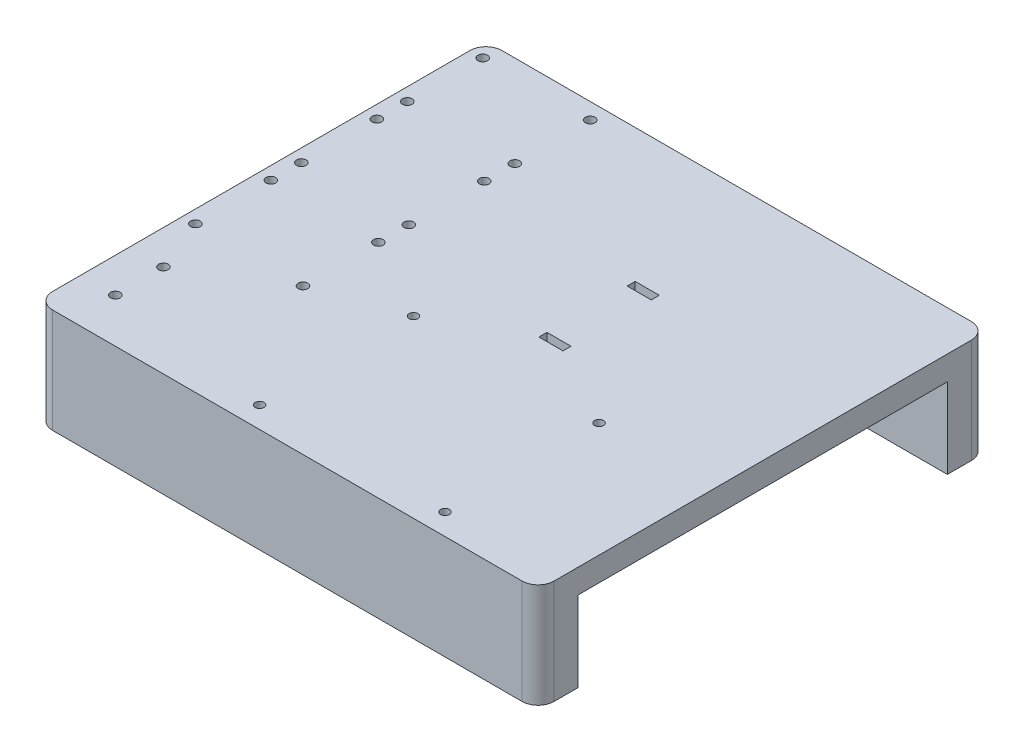
from build123d import *

# Parameters (mm, degrees)
BOSS_EXTRUDE1_DEPTH = 7.62
SKETCH5_W           = 158.75
SKETCH5_H           = 12.7
BOSS_EXTRUDE2_DEPTH = 25.4
FILLET1_R           = 5.08
SKETCH3_R           = 1.397
SKETCH3_R_2         = 1.524
CUT_EXTRUDE1_DEPTH  = 7.62
SKETCH6_W           = 7.62
SKETCH6_H           = 2.54
CUT_EXTRUDE3_DEPTH  = 7.62


with BuildPart() as part:
    # Sketch1 → Boss-Extrude1 (new body)
    with BuildSketch(Plane(origin=(0, 0, 0), x_dir=(1, 0, 0), z_dir=(0, 1, 0))):
        Polygon((0, 0), (120.65, 0), (120.65, 142.24), (-38.1, 142.24), (-38.1, 0), align=None)
    extrude(amount=BOSS_EXTRUDE1_DEPTH)

    # Sketch5 → Boss-Extrude2 (add)
    with BuildSketch(Plane(origin=(0, 0, 0), x_dir=(-1, 0, 0), z_dir=(0, -1, 0))):
        with Locations((-41.275, 6.35)):
            Rectangle(SKETCH5_W, SKETCH5_H)
        with Locations((-41.275, 135.89)):
            Rectangle(SKETCH5_W, SKETCH5_H)
    extrude(amount=BOSS_EXTRUDE2_DEPTH)

    # Fillet1
    fillet1_edges = [part.edges().sort_by_distance(p)[0] for p in [
        (-38.1, -8.89, 0),
        (120.65, -8.89, 0),
        (120.65, -8.89, -142.24),
        (-38.1, -8.89, -142.24),
    ]]
    fillet(fillet1_edges, radius=FILLET1_R)

    # Sketch3 → Cut-Extrude1 (cut)
    with BuildSketch(Plane(origin=(0, 7.62, 0), x_dir=(1, 0, 0), z_dir=(0, 1, 0))):
        with Locations((25.781, 6.731)):
            Circle(SKETCH3_R)
        with Locations((25.781, 55.4355)):
            Circle(SKETCH3_R)
        with Locations((84.455, 55.499)):
            Circle(SKETCH3_R)
        with Locations((84.455, 6.731)):
            Circle(SKETCH3_R)
        with Locations((-34.036, 137.16)):
            Circle(SKETCH3_R_2)
        with Locations((0, 137.16)):
            Circle(SKETCH3_R_2)
        with Locations((-34.036, 113.284)):
            Circle(SKETCH3_R_2)
        with Locations((0, 113.284)):
            Circle(SKETCH3_R_2)
        with Locations((-34.036, 103.632)):
            Circle(SKETCH3_R_2)
        with Locations((0, 103.632)):
            Circle(SKETCH3_R_2)
        with Locations((-34.036, 79.756)):
            Circle(SKETCH3_R_2)
        with Locations((0, 79.756)):
            Circle(SKETCH3_R_2)
        with Locations((-34.036, 70.104)):
            Circle(SKETCH3_R_2)
        with Locations((0, 70.104)):
            Circle(SKETCH3_R_2)
        with Locations((-34.036, 46.228)):
            Circle(SKETCH3_R_2)
        with Locations((0, 46.228)):
            Circle(SKETCH3_R_2)
        with Locations((-27.178, 14.003291804)):
            Circle(SKETCH3_R_2)
        with Locations((-27.269651582, 29.334943362)):
            Circle(SKETCH3_R_2)
    extrude(amount=-CUT_EXTRUDE1_DEPTH, mode=Mode.SUBTRACT)

    # Sketch6 → Cut-Extrude3 (cut)
    with BuildSketch(Plane(origin=(0, 7.62, 0), x_dir=(1, 0, 0), z_dir=(0, 1, 0))):
        with Locations((55.167188758, 70.832515898)):
            Rectangle(SKETCH6_W, SKETCH6_H)
        with Locations((55.167188758, 98.772515898)):
            Rectangle(SKETCH6_W, SKETCH6_H)
    extrude(amount=-CUT_EXTRUDE3_DEPTH, mode=Mode.SUBTRACT)


solid = part.part
